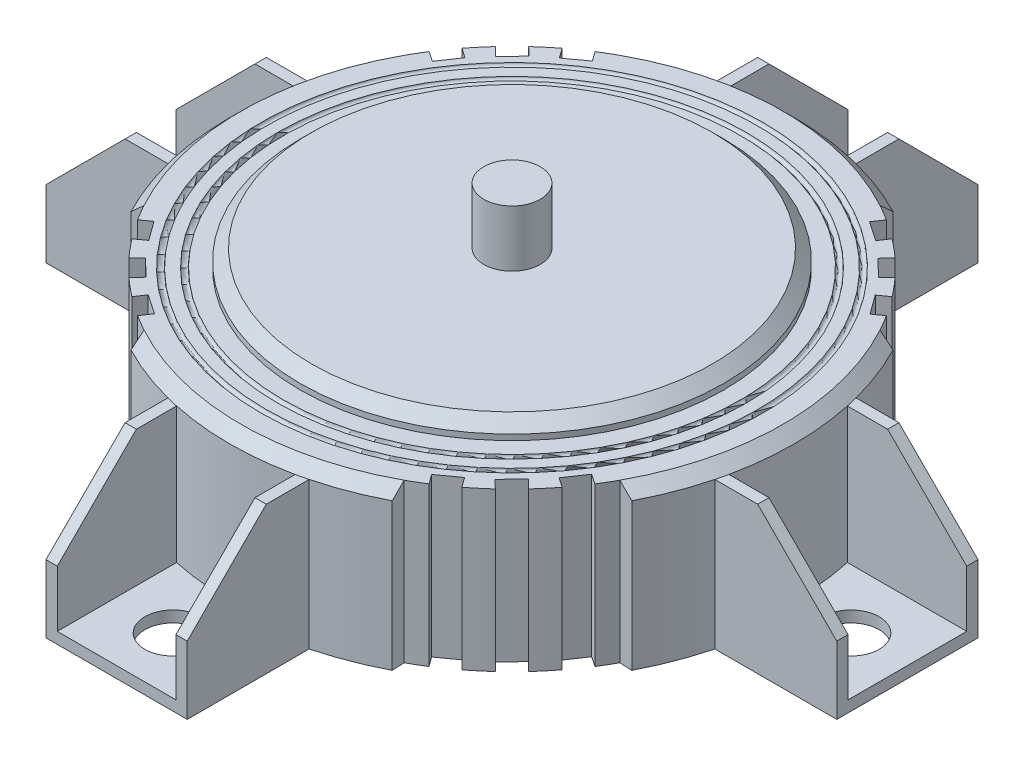
from build123d import *

# Parameters (mm, degrees)
CHAMFER1_SIZE                   = 2
BOSS_EXTRUDE1_DEPTH             = 70
CHAMFER2_SIZE                   = 14
SKETCH3_R                       = 5
CUT_EXTRUDE1_DEPTH              = 70
CIRPATTERN1_COUNT               = 4
CHAMFER2_OF_CIRPATTERN1_SIZE    = 14
CUT_EXTRUDE2_START              = 70
CUT_EXTRUDE2_DEPTH              = 70
CUT_EXTRUDE3_DEPTH              = 70
CIRPATTERN2_COUNT               = 2
CIRPATTERN2_ANGLE               = 10
CIRPATTERN2_THE_OTHER_WAY_COUNT = 2
CIRPATTERN2_THE_OTHER_WAY_ANGLE = 10
CIRPATTERN3_COUNT               = 4
CIRPATTERN3_COPY_1_DEPTH        = 70
CIRPATTERN3_COPY_2_DEPTH        = 70
CIRPATTERN3_COPY_3_DEPTH        = 70
CIRPATTERN3_COPY_4_DEPTH        = 70
CIRPATTERN3_COPY_5_DEPTH        = 70
CIRPATTERN3_COPY_6_DEPTH        = 70
CUT_SWEEP2_PROFILE_R            = 0.5
CUT_SWEEP3_PROFILE_R            = 0.5
CUT_EXTRUDE4_START              = -10
SKETCH27_R                      = 37.5
CUT_EXTRUDE4_DEPTH              = 10


with BuildPart() as part:
    # Sketch1 → Revolve1 (revolve)
    with BuildSketch(Plane.XY, mode=Mode.PRIVATE) as revolve1_sk:
        Polygon((0, 0), (-50, 0), (-50, 28), (-37.5, 28), (-37.5, 31), (-5, 31), (-5, 41), (0, 41), align=None)
    revolve(revolve1_sk.sketch.rotate(Axis((0, 0, 0), (0, 1, 0)), 270), axis=Axis((0, 0, 0), (0, 1, 0)))

    # Chamfer1
    chamfer1_edges = [part.edges().sort_by_distance(p)[0] for p in [
        (0, 31, 37.5),
        (0, 28, 50),
    ]]
    chamfer(chamfer1_edges, length=CHAMFER1_SIZE)

    # Sketch2 → Boss-Extrude1 (add)
    with BuildSketch(Plane.XY):
        Polygon((12.5, 0), (-12.5, 0), (-12.5, 26), (-10.5, 26), (-10.5, 2), (10.5, 2), (10.5, 26), (12.5, 26), align=None)
    boss_extrude1 = extrude(amount=BOSS_EXTRUDE1_DEPTH)

    # Chamfer2
    chamfer2_edges = [part.edges().sort_by_distance(p)[0] for p in [
        (-11.5, 26, 70),
        (11.5, 26, 70),
    ]]
    chamfer(chamfer2_edges, length=CHAMFER2_SIZE)

    # Sketch3 → Cut-Extrude1 (cut)
    with BuildSketch(Plane(origin=(0, 31, 0), x_dir=(1, 0, 0), z_dir=(0, 1, 0))):
        with Locations(Location((0, -60, 0), (0, 0, 270))):
            Circle(SKETCH3_R)
    cut_extrude1 = extrude(amount=-CUT_EXTRUDE1_DEPTH, mode=Mode.SUBTRACT)

    # CirPattern1: Boss-Extrude1, Cut-Extrude1 ×4 about axis
    cirpattern1_axis = Axis((0, 0, 0), (0, 1, 0))
    add([boss_extrude1.rotate(cirpattern1_axis, i * 360 / CIRPATTERN1_COUNT) for i in range(1, CIRPATTERN1_COUNT)])
    add([cut_extrude1.rotate(cirpattern1_axis, i * 360 / CIRPATTERN1_COUNT) for i in range(1, CIRPATTERN1_COUNT)], mode=Mode.SUBTRACT)

    # Chamfer2 of CirPattern1
    chamfer2_of_cirpattern1_edges = [part.edges().sort_by_distance(p)[0] for p in [
        (70, 26, 11.5),
        (70, 26, -11.5),
        (11.5, 26, -70),
        (-11.5, 26, -70),
        (-70, 26, -11.5),
        (-70, 26, 11.5),
    ]]
    chamfer(chamfer2_of_cirpattern1_edges, length=CHAMFER2_OF_CIRPATTERN1_SIZE)

    # Sketch4 → Cut-Extrude2 (cut)
    with BuildSketch(Plane(origin=(0, 0, 0), x_dir=(1, 0, 0), z_dir=(0, 1, 0)).offset(CUT_EXTRUDE2_START)):
        with BuildLine():
            Line((23.02513458, -42.117017672), (23.12024219, -44.333445626))
            ThreePointArc((23.12024219, -44.333445626), (35.355339059, -35.355339059), (44.333445626, -23.12024219))
            Line((44.333445626, -23.12024219), (42.117017672, -23.02513458))
            ThreePointArc((42.117017672, -23.02513458), (33.941125497, -33.941125497), (23.02513458, -42.117017672))
        make_face()
    cut_extrude2 = extrude(amount=-CUT_EXTRUDE2_DEPTH, mode=Mode.SUBTRACT)

    # Sketch5 → Cut-Extrude3 (cut)
    with BuildSketch(Plane(origin=(0, 0, 0), x_dir=(1, 0, 0), z_dir=(0, 1, 0))):
        Polygon((30.939685977, -33.941125497), (34.034072747, -36.941125497), (36.942565017, -33.941125497), (33.848178247, -30.941125497), align=None)
    cut_extrude3 = extrude(amount=CUT_EXTRUDE3_DEPTH, mode=Mode.SUBTRACT)

    # CirPattern2: Cut-Extrude3 ×2 about axis
    cirpattern2_axis = Axis((0, 0, 0), (0, 1, 0))
    for i in range(1, CIRPATTERN2_COUNT):
        add(cut_extrude3.rotate(cirpattern2_axis, i * CIRPATTERN2_ANGLE / (CIRPATTERN2_COUNT - 1)), mode=Mode.SUBTRACT)

    # CirPattern2 the other way: Cut-Extrude3 ×2 about axis
    cirpattern2_the_other_way_axis = Axis((0, 0, 0), (0, -1, 0))
    for i in range(1, CIRPATTERN2_THE_OTHER_WAY_COUNT):
        add(cut_extrude3.rotate(cirpattern2_the_other_way_axis, i * CIRPATTERN2_THE_OTHER_WAY_ANGLE / (CIRPATTERN2_THE_OTHER_WAY_COUNT - 1)), mode=Mode.SUBTRACT)

    # CirPattern3: Cut-Extrude2, Cut-Extrude3 ×4 about axis
    cirpattern3_axis = Axis((0, 0, 0), (0, 1, 0))
    add([cut_extrude2.rotate(cirpattern3_axis, i * 360 / CIRPATTERN3_COUNT) for i in range(1, CIRPATTERN3_COUNT)], mode=Mode.SUBTRACT)
    add([cut_extrude3.rotate(cirpattern3_axis, i * 360 / CIRPATTERN3_COUNT) for i in range(1, CIRPATTERN3_COUNT)], mode=Mode.SUBTRACT)

    # CirPattern3 copy 1 sketch → CirPattern3 copy 1 (cut)
    with BuildSketch(Plane(origin=(0, 0, 0), x_dir=(-0.1736481776669307, 0, -0.984807753012208), z_dir=(0, 1, 0))):
        Polygon((30.939685977, -33.941125497), (34.034072747, -36.941125497), (36.942565017, -33.941125497), (33.848178247, -30.941125497), align=None)
    extrude(amount=CIRPATTERN3_COPY_1_DEPTH, mode=Mode.SUBTRACT)

    # CirPattern3 copy 2 sketch → CirPattern3 copy 2 (cut)
    with BuildSketch(Plane(origin=(0, 0, 0), x_dir=(-0.984807753012208, 0, 0.17364817766693064), z_dir=(0, 1, 0))):
        Polygon((30.939685977, -33.941125497), (34.034072747, -36.941125497), (36.942565017, -33.941125497), (33.848178247, -30.941125497), align=None)
    extrude(amount=CIRPATTERN3_COPY_2_DEPTH, mode=Mode.SUBTRACT)

    # CirPattern3 copy 3 sketch → CirPattern3 copy 3 (cut)
    with BuildSketch(Plane(origin=(0, 0, 0), x_dir=(0.17364817766693055, 0, 0.984807753012208), z_dir=(0, 1, 0))):
        Polygon((30.939685977, -33.941125497), (34.034072747, -36.941125497), (36.942565017, -33.941125497), (33.848178247, -30.941125497), align=None)
    extrude(amount=CIRPATTERN3_COPY_3_DEPTH, mode=Mode.SUBTRACT)

    # CirPattern3 copy 4 sketch → CirPattern3 copy 4 (cut)
    with BuildSketch(Plane(origin=(0, 0, 0), x_dir=(0.1736481776669308, 0, -0.984807753012208), z_dir=(0, 1, 0))):
        Polygon((30.939685977, -33.941125497), (34.034072747, -36.941125497), (36.942565017, -33.941125497), (33.848178247, -30.941125497), align=None)
    extrude(amount=CIRPATTERN3_COPY_4_DEPTH, mode=Mode.SUBTRACT)

    # CirPattern3 copy 5 sketch → CirPattern3 copy 5 (cut)
    with BuildSketch(Plane(origin=(0, 0, 0), x_dir=(-0.984807753012208, 0, -0.17364817766693086), z_dir=(0, 1, 0))):
        Polygon((30.939685977, -33.941125497), (34.034072747, -36.941125497), (36.942565017, -33.941125497), (33.848178247, -30.941125497), align=None)
    extrude(amount=CIRPATTERN3_COPY_5_DEPTH, mode=Mode.SUBTRACT)

    # CirPattern3 copy 6 sketch → CirPattern3 copy 6 (cut)
    with BuildSketch(Plane(origin=(0, 0, 0), x_dir=(-0.17364817766693094, 0, 0.984807753012208), z_dir=(0, 1, 0))):
        Polygon((30.939685977, -33.941125497), (34.034072747, -36.941125497), (36.942565017, -33.941125497), (33.848178247, -30.941125497), align=None)
    extrude(amount=CIRPATTERN3_COPY_6_DEPTH, mode=Mode.SUBTRACT)

    # Cut-Sweep2: sweep along a path in Sketch15
    with BuildLine(Plane(origin=(0, 28, 0), x_dir=(1, 0, 0), z_dir=(0, 1, 0))) as cut_sweep2_path:
        CenterArc((0, 0), 44, 0, 360)
    # Cut-Sweep2 profile (on start of the path) → Cut-Sweep2 (sweep, cut)
    with BuildSketch(Plane(origin=(44, 28, 0), x_dir=(-1, 0, 0), z_dir=(0, 0, -1))):
        Circle(CUT_SWEEP2_PROFILE_R)
    sweep(path=cut_sweep2_path.line, mode=Mode.SUBTRACT)

    # Cut-Sweep3: sweep along a path in Sketch14
    with BuildLine(Plane(origin=(0, 28, 0), x_dir=(1, 0, 0), z_dir=(0, 1, 0))) as cut_sweep3_path:
        CenterArc((0, 0), 41, 0, 360)
    # Cut-Sweep3 profile (on start of the path) → Cut-Sweep3 (sweep, cut)
    with BuildSketch(Plane(origin=(41, 28, 0), x_dir=(-1, 0, 0), z_dir=(0, 0, -1))):
        Circle(CUT_SWEEP3_PROFILE_R)
    sweep(path=cut_sweep3_path.line, mode=Mode.SUBTRACT)

    # Sketch27 → Cut-Extrude4 (cut)
    with BuildSketch(Plane.XZ.offset(CUT_EXTRUDE4_START)):
        with Locations(Location((0, 0, 0), (0, 0, 270))):
            Circle(SKETCH27_R)
    extrude(amount=CUT_EXTRUDE4_DEPTH, mode=Mode.SUBTRACT)


solid = part.part
